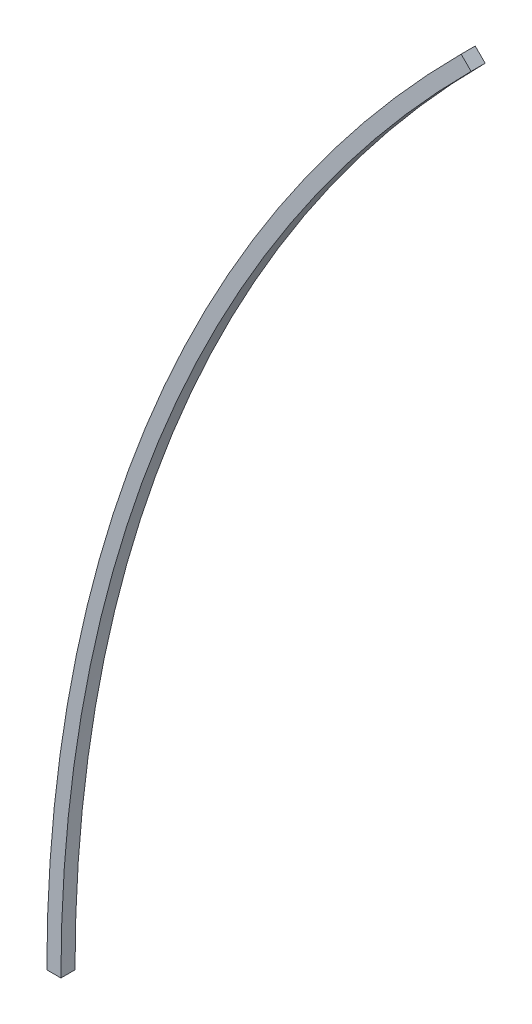
from build123d import *

# Parameters (mm, degrees)
SKETCH4_W      = 25.4
SKETCH4_H      = 25.4
REVOLVE1_ANGLE = 45


with BuildPart() as part:
    # Sketch4 → Revolve1 (revolve)
    with BuildSketch(Plane(origin=(0, 0, 0), x_dir=(1, 0, 0), z_dir=(0, 1, 0))):
        Rectangle(SKETCH4_W, SKETCH4_H)
    revolve(axis=Axis((2540, 0, 0), (0, 0, -1)), revolution_arc=REVOLVE1_ANGLE)


solid = part.part
